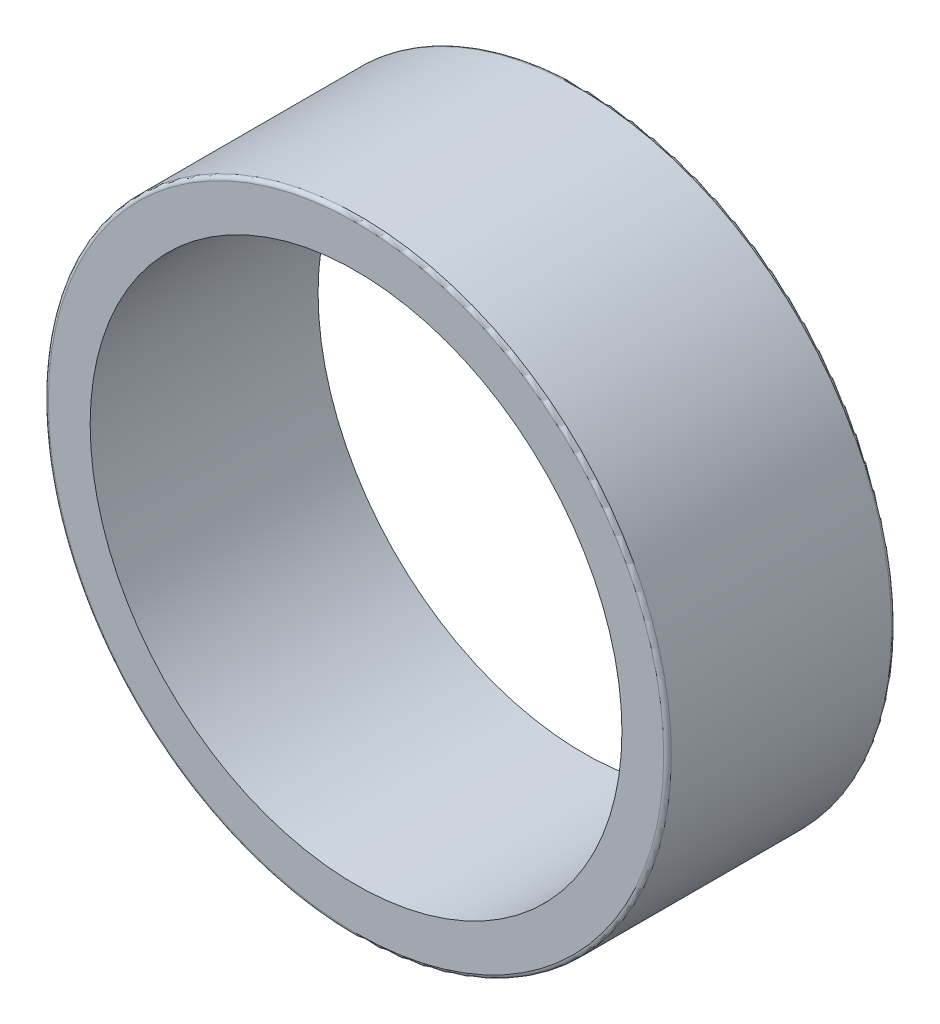
from build123d import *

# Parameters (mm, degrees)
SKETCH1_R           = 4.1
SKETCH1_R_2         = 3.5
BOSS_EXTRUDE1_DEPTH = 1.5
FILLET1_R           = 0.05


with BuildPart() as part:
    # Sketch1 → Boss-Extrude1 (new, symmetric)
    with BuildSketch(Plane.XY):
        Circle(SKETCH1_R)
        Circle(SKETCH1_R_2, mode=Mode.SUBTRACT)
    extrude(amount=BOSS_EXTRUDE1_DEPTH, both=True)

    # Fillet1
    fillet1_edges = [part.edges().sort_by_distance(p)[0] for p in [
        (-4.1, 0, -1.5),
        (-4.1, 0, 1.5),
    ]]
    fillet(fillet1_edges, radius=FILLET1_R)


solid = part.part
